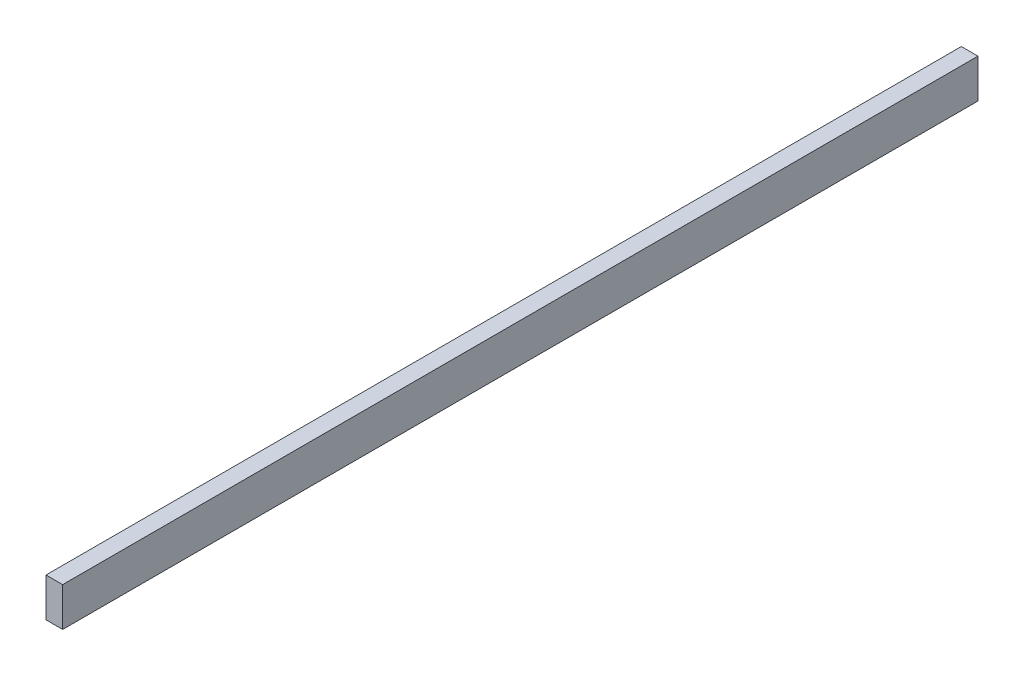
from build123d import *

# Parameters (mm, degrees)
SKETCH1_W           = 38.1
SKETCH1_H           = 88.9
BOSS_EXTRUDE1_DEPTH = 2093.9125


with BuildPart() as part:
    # Sketch1 → Boss-Extrude1 (new body)
    with BuildSketch(Plane.XY):
        with Locations((19.05, 44.45)):
            Rectangle(SKETCH1_W, SKETCH1_H)
    extrude(amount=BOSS_EXTRUDE1_DEPTH)


solid = part.part
